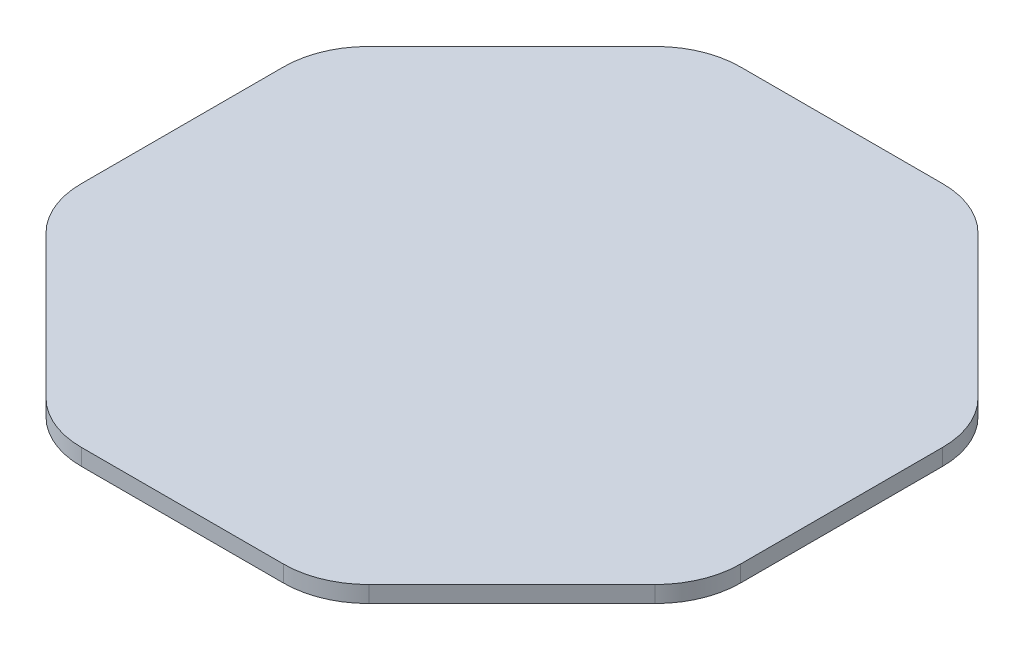
from build123d import *

# Parameters (mm, degrees)
EXTRUDE_1_DEPTH = 3
FILLET_1_R      = 15.5


with BuildPart() as part:
    # 草图1 → 凸台-拉伸1 (new body)
    with BuildSketch(Plane(origin=(0, 0, 0), x_dir=(1, 0, 0), z_dir=(0, 1, 0))):
        Polygon((24.852813742, 60), (-24.852813742, 60), (-60, 24.852813742), (-60, -24.852813742), (-24.852813742, -60), (24.852813742, -60), (60, -24.852813742), (60, 24.852813742), align=None)
    extrude(amount=EXTRUDE_1_DEPTH)

    # 圆角1
    fillet_1_edges = [part.edges().sort_by_distance(p)[0] for p in [
        (-60, 1.5, -24.852813742),
        (-24.852813742, 1.5, -60),
        (24.852813742, 1.5, -60),
        (60, 1.5, 24.852813742),
        (-24.852813742, 1.5, 60),
        (-60, 1.5, 24.852813742),
        (24.852813742, 1.5, 60),
        (60, 1.5, -24.852813742),
    ]]
    fillet(fillet_1_edges, radius=FILLET_1_R)


solid = part.part
